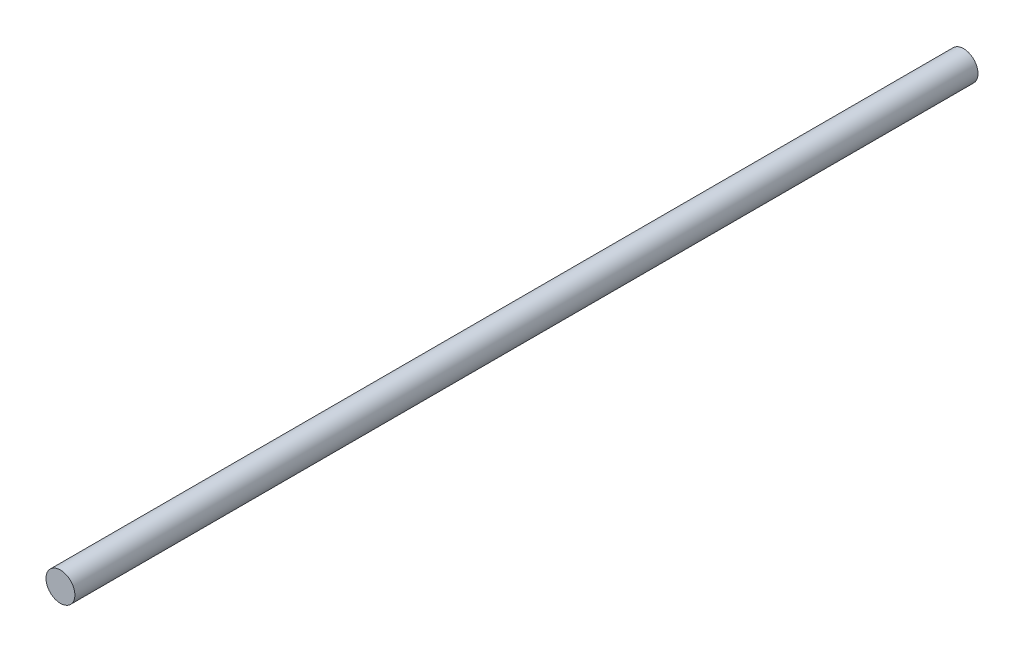
from build123d import *

# Parameters (mm, degrees)
ESQUISSE1_R        = 4
BOSS_EXTRU_1_DEPTH = 250


with BuildPart() as part:
    # Esquisse1 → Boss.-Extru.1 (new body)
    with BuildSketch(Plane.XY):
        Circle(ESQUISSE1_R)
    extrude(amount=BOSS_EXTRU_1_DEPTH)


solid = part.part
